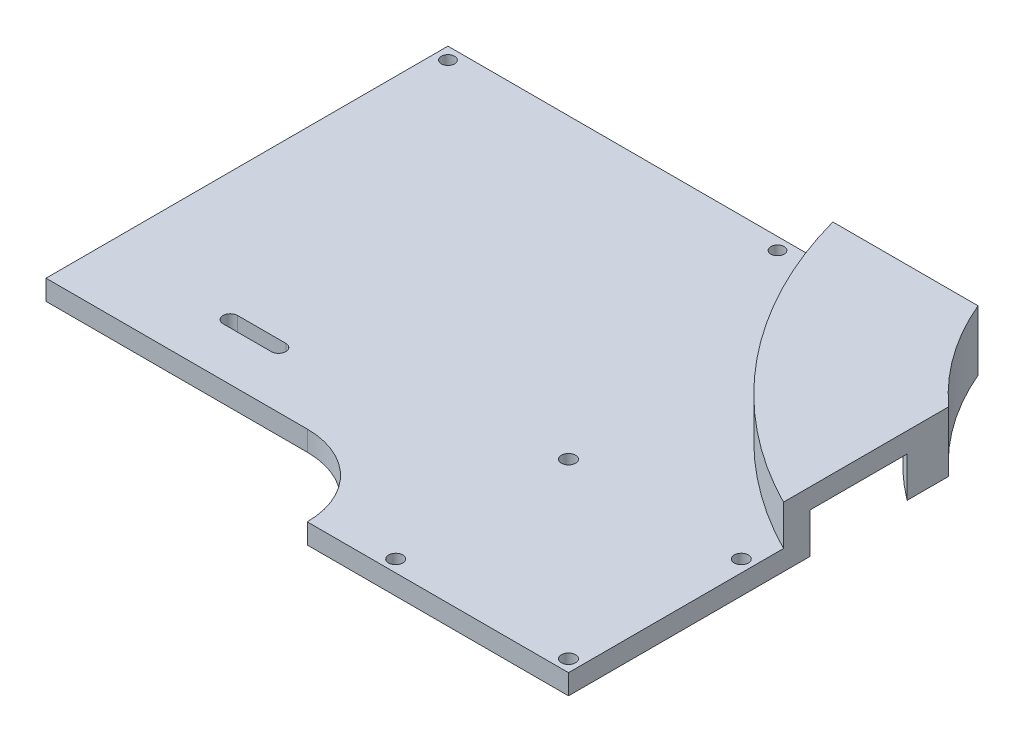
from build123d import *

# Parameters (mm, degrees)
SKETCH_2_W          = 150
SKETCH_2_H          = 120
EXTRUDE_1_DEPTH     = 5
SKETCH_3_R          = 1.65
SKETCH_3_R_2        = 1.75
CUT_EXTRUDE_1_DEPTH = 5
EXTRUDE_3_DEPTH     = 5
EXTRUDE_4_DEPTH     = 5
CUT_EXTRUDE_START   = -5
CUT_EXTRUDE_2_DEPTH = 5
CUT_EXTRUDE_4_DEPTH = 20
CUT_EXTRUDE_5_DEPTH = 10


with BuildPart() as part:
    # 草图2 → 凸台-拉伸1 (new body)
    with BuildSketch(Plane(origin=(0, 0, 0), x_dir=(1, 0, 0), z_dir=(0, 1, 0))):
        Rectangle(SKETCH_2_W, SKETCH_2_H)
    extrude(amount=EXTRUDE_1_DEPTH)

    # 草图3 → 切除-拉伸1 (cut)
    with BuildSketch(Plane(origin=(0, 5, 0), x_dir=(1, 0, 0), z_dir=(0, 1, 0))):
        with Locations(Location((-72, 57, 0), (0, 0, 270))):
            Circle(SKETCH_3_R)
        with Locations(Location((10, 57, 0), (0, 0, 270))):
            Circle(SKETCH_3_R)
        with Locations(Location((72, -57, 0), (0, 0, 270))):
            Circle(SKETCH_3_R_2)
        with Locations(Location((29, -57, 0), (0, 0, 270))):
            Circle(SKETCH_3_R_2)
        with Locations(Location((72, -14, 0), (0, 0, 270))):
            Circle(SKETCH_3_R_2)
        with Locations(Location((29, -14, 0), (0, 0, 270))):
            Circle(SKETCH_3_R_2)
        with BuildLine():
            Line((-43.138351407, -24.2), (-31.138351407, -24.2))
            ThreePointArc((-31.138351407, -24.2), (-29.338351407, -26), (-31.138351407, -27.8))
            Line((-31.138351407, -27.8), (-43.138351407, -27.8))
            ThreePointArc((-43.138351407, -27.8), (-44.938351407, -26), (-43.138351407, -24.2))
        make_face()
    extrude(amount=-CUT_EXTRUDE_1_DEPTH, mode=Mode.SUBTRACT)

    # 草图4 → 凸台-拉伸3 (add)
    with BuildSketch(Plane(origin=(0, 5, 0), x_dir=(1, 0, 0), z_dir=(0, 1, 0))):
        with BuildLine():
            Line((75, 24.250176471), (75, 60))
            Line((75, 60), (48.273565588, 60))
            ThreePointArc((48.273565588, 60), (59.086332475, 40.218381113), (75, 24.250176471))
        make_face()
        with BuildLine():
            Line((75, -6.509258806), (75, 0.045238901))
            ThreePointArc((75, 0.045238901), (44.912530325, 25.211568901), (26.791684351, 60))
            Line((26.791684351, 60), (20.764976647, 60))
            ThreePointArc((20.764976647, 60), (40.850679022, 21.0112766), (75, -6.509258806))
        make_face()
    extrude(amount=EXTRUDE_3_DEPTH)

    # 草图5 → 凸台-拉伸4 (add)
    with BuildSketch(Plane(origin=(0, 10, 0), x_dir=(1, 0, 0), z_dir=(0, 1, 0))):
        with BuildLine():
            Line((20.764976647, 60), (75, 60))
            Line((75, 60), (75, -6.509258806))
            ThreePointArc((75, -6.509258806), (40.850679022, 21.0112766), (20.764976647, 60))
        make_face()
    extrude(amount=EXTRUDE_4_DEPTH)

    # 草图6 → 切除-拉伸2 (cut)
    with BuildSketch(Plane(origin=(0, 5, 0), x_dir=(1, 0, 0), z_dir=(0, 1, 0)).offset(CUT_EXTRUDE_START)):
        with BuildLine():
            Line((48.273565588, 60), (26.791684351, 60))
            ThreePointArc((26.791684351, 60), (44.912530325, 25.211568901), (75, 0.045238901))
            Line((75, 0.045238901), (75, 24.250176471))
            ThreePointArc((75, 24.250176471), (59.086332475, 40.218381113), (48.273565588, 60))
        make_face()
    extrude(amount=CUT_EXTRUDE_2_DEPTH, mode=Mode.SUBTRACT)

    # 草图7 → 切除-拉伸4 (cut)
    with BuildSketch(Plane.XZ):
        with BuildLine():
            ThreePointArc((56.884646261, -60), (56.310021612, -61.397616975), (55.764937458, -62.807017544))
            Line((55.764937458, -62.807017544), (81.923412231, -71.445579772))
            Line((81.923412231, -71.445579772), (79.812030075, -30.641136223))
            ThreePointArc((79.812030075, -30.641136223), (77.363002414, -32.56982364), (75, -34.602996339))
            Line((75, -34.602996339), (75, -60))
            Line((75, -60), (56.884646261, -60))
        make_face()
        with BuildLine():
            ThreePointArc((75, -34.602996339), (64.546339392, -46.305761051), (56.884646261, -60))
            Line((56.884646261, -60), (75, -60))
            Line((75, -60), (75, -34.602996339))
        make_face()
    extrude(amount=-CUT_EXTRUDE_4_DEPTH, mode=Mode.SUBTRACT)

    # 草图8 → 切除-拉伸5 (cut)
    with BuildSketch(Plane(origin=(0, 5, 0), x_dir=(1, 0, 0), z_dir=(0, 1, 0))):
        with BuildLine():
            Line((-75, -40), (-10, -40))
            ThreePointArc((-10, -40), (10, -60), (-10, -80))
            Line((-10, -80), (-75, -80))
            ThreePointArc((-75, -80), (-95, -60), (-75, -40))
        make_face()
    extrude(amount=-CUT_EXTRUDE_5_DEPTH, mode=Mode.SUBTRACT)


solid = part.part
